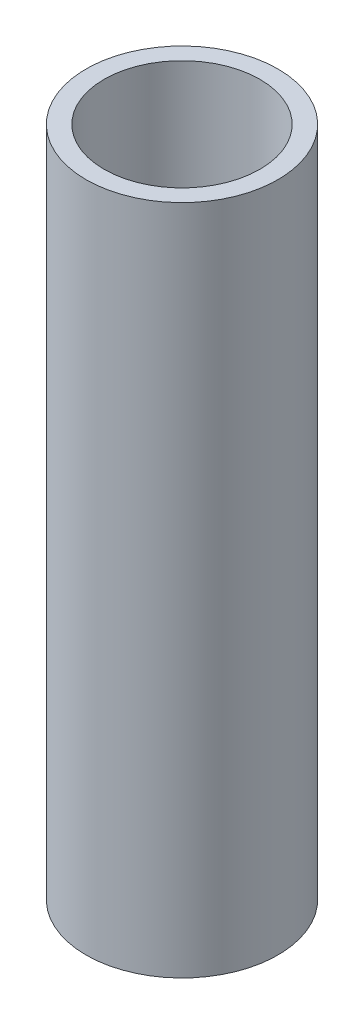
from build123d import *

# Parameters (mm, degrees)
SKETCH1_R           = 4
SKETCH1_R_2         = 3.25
BOSS_EXTRUDE1_DEPTH = 28


with BuildPart() as part:
    # Sketch1 → Boss-Extrude1 (new body)
    with BuildSketch(Plane(origin=(0, 0, 0), x_dir=(1, 0, 0), z_dir=(0, 1, 0))):
        with Locations(Location((0, 0, 0), (0, 0, 270))):
            Circle(SKETCH1_R)
        with Locations(Location((0, 0, 0), (0, 0, 270))):
            Circle(SKETCH1_R_2, mode=Mode.SUBTRACT)
    extrude(amount=BOSS_EXTRUDE1_DEPTH)


solid = part.part
